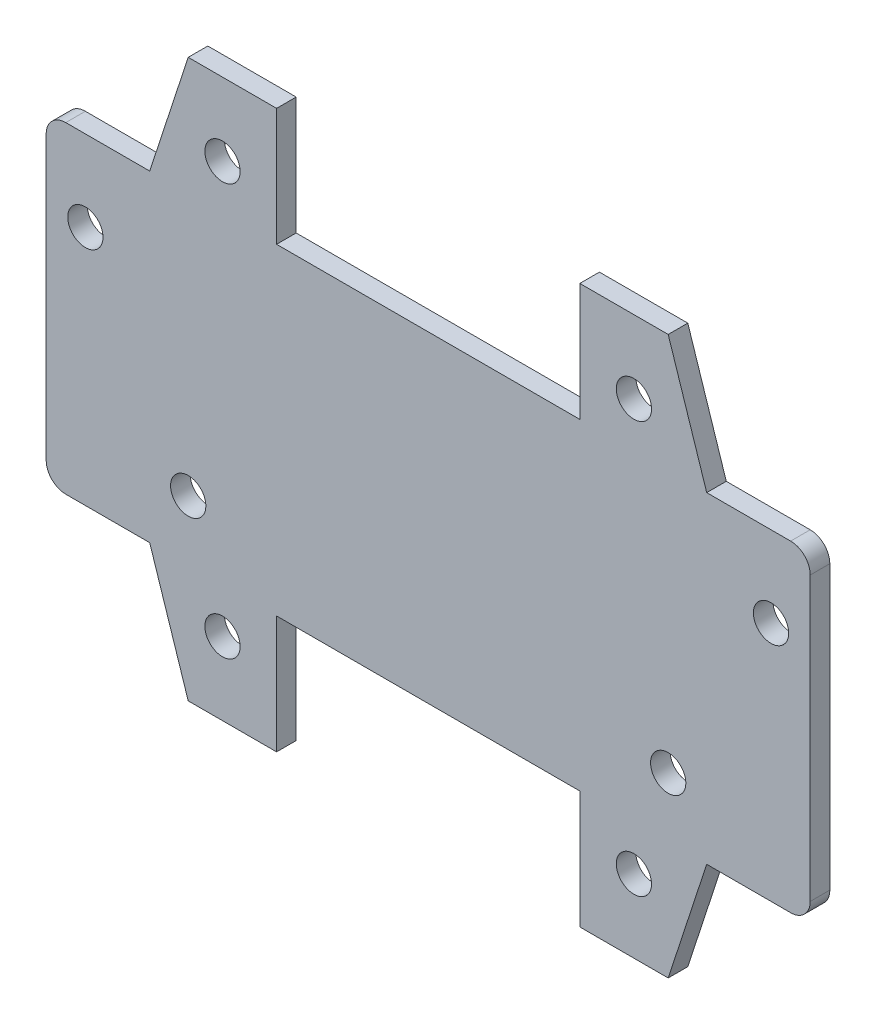
from build123d import *

# Parameters (mm, degrees)
SKETCH_1_R      = 1.8
EXTRUDE_1_DEPTH = 2
FILLET_1_R      = 2


with BuildPart() as part:
    # 草图1 → 凸台-拉伸1 (new body)
    with BuildSketch(Plane.XY):
        Polygon((15.478457886, -16.428571429), (-15.478457886, -16.428571429), (-15.478457886, -28.449015282), (-24.5, -28.449015282), (-28.430563732, -16.428571429), (-39, -16.428571429), (-39, 16.428571429), (-28.430563732, 16.428571429), (-24.5, 28.449015282), (-15.478457886, 28.449015282), (-15.478457886, 16.428571429), (15.478457886, 16.428571429), (15.478457886, 28.449015282), (24.5, 28.449015282), (28.430563732, 16.428571429), (39, 16.428571429), (39, -16.428571429), (28.430563732, -16.428571429), (24.5, -28.449015282), (15.478457886, -28.449015282), align=None)
        with Locations((-21, 21)):
            Circle(SKETCH_1_R, mode=Mode.SUBTRACT)
        with Locations((21, 21)):
            Circle(SKETCH_1_R, mode=Mode.SUBTRACT)
        with Locations((24.5, -10.320512821)):
            Circle(SKETCH_1_R, mode=Mode.SUBTRACT)
        with Locations((-24.5, -10.320512821)):
            Circle(SKETCH_1_R, mode=Mode.SUBTRACT)
        with Locations((35, 8.179487179)):
            Circle(SKETCH_1_R, mode=Mode.SUBTRACT)
        with Locations((-35, 8.179487179)):
            Circle(SKETCH_1_R, mode=Mode.SUBTRACT)
        with Locations((-21, -21)):
            Circle(SKETCH_1_R, mode=Mode.SUBTRACT)
        with Locations((21, -21)):
            Circle(SKETCH_1_R, mode=Mode.SUBTRACT)
    extrude(amount=EXTRUDE_1_DEPTH)

    # 圆角1
    fillet_1_edges = [part.edges().sort_by_distance(p)[0] for p in [
        (-39, -16.428571429, 1),
        (-39, 16.428571429, 1),
        (39, 16.428571429, 1),
        (39, -16.428571429, 1),
    ]]
    fillet(fillet_1_edges, radius=FILLET_1_R)


solid = part.part
